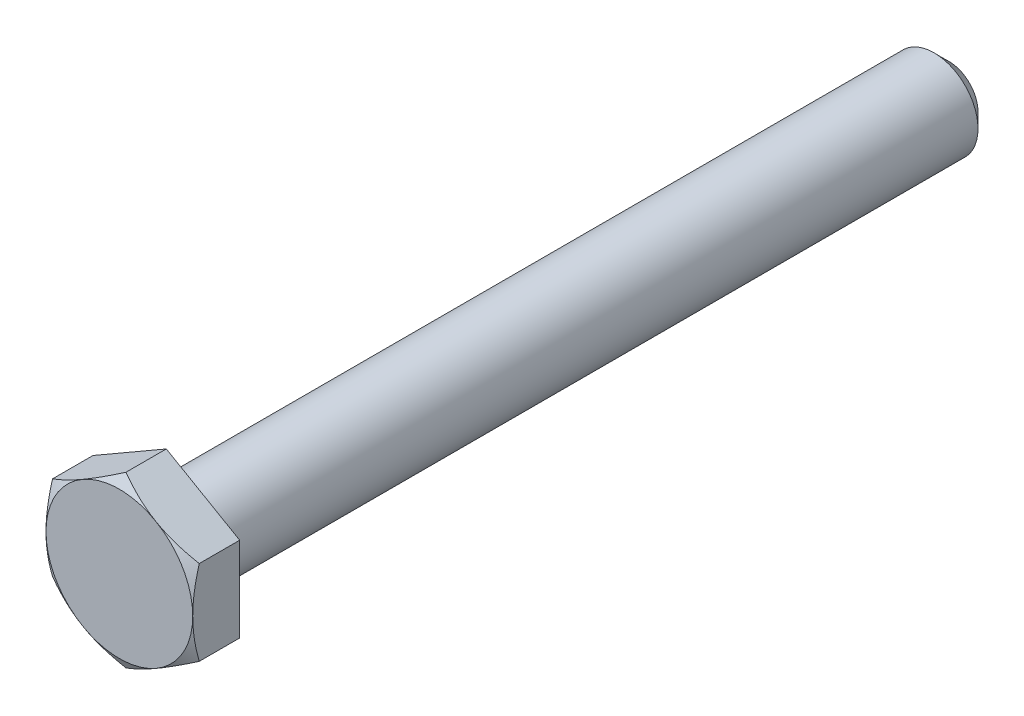
from build123d import *

# Parameters (mm, degrees)
EXTRUDE3_DEPTH     = 1.524
SKETCH4_W          = 25.4
SKETCH4_H          = 1.4224
CHAMFER2_SIZE      = 0.47625
SKETCH26_R         = 0.5461
EXTRUDE12_DEPTH    = 1.524
SKETCH30_OUTSIDE_W = 21.138
SKETCH30_OUTSIDE_H = 21.876
SKETCH30_OUTSIDE_R = 2.38125
EXTRUDE13_DEPTH    = 2.54
EXTRUDE13_DRAFT    = -60


with BuildPart() as part:
    # Sketch1 → Extrude3 (new body)
    with BuildSketch(Plane.XY):
        Polygon((-2.38125, -1.374815329), (0, -2.749630657), (2.38125, -1.374815329), (2.38125, 1.374815329), (0, 2.749630657), (-2.38125, 1.374815329), align=None)
    extrude(amount=EXTRUDE3_DEPTH)



with BuildPart() as body_2:
    # Sketch4 → Revolve1 (revolve)
    with BuildSketch(Plane(origin=(0, 0, 0), x_dir=(0, 0, -1), z_dir=(1, 0, 0)), mode=Mode.PRIVATE) as revolve1_sk:
        with Locations((12.7, 0.7112)):
            Rectangle(SKETCH4_W, SKETCH4_H)
    revolve(revolve1_sk.sketch.rotate(Axis((0, 0, 0), (0, 0, -1)), 90), axis=Axis((0, 0, 0), (0, 0, -1)))

    # Chamfer2
    chamfer2_edges = [body_2.edges().sort_by_distance(p)[0] for p in [
        (-1.4224, 0, -25.4),
    ]]
    chamfer(chamfer2_edges, length=CHAMFER2_SIZE)


with BuildPart() as part_1:
    add(part.part)

    add(body_2.part)  # Extrude12 merges body 2
    # Sketch26 → Extrude12 (add)
    with BuildSketch(Plane.XY):
        Circle(SKETCH26_R)
    extrude(amount=EXTRUDE12_DEPTH)


with BuildPart() as extrude13_tool:
    # Sketch30 outside → Extrude13 (with draft: the straight prism first)
    with BuildSketch(Plane.XY.offset(1.524)):
        Rectangle(SKETCH30_OUTSIDE_W, SKETCH30_OUTSIDE_H)
        Circle(SKETCH30_OUTSIDE_R, mode=Mode.SUBTRACT)
    extrude(amount=-EXTRUDE13_DEPTH)
    # Extrude13: the draft: its side faces are tilted about the plane it starts from
    extrude13_sides = [extrude13_tool.faces().sort_by_distance(p)[0] for p in [
        (0, -10.938, 0.254),
        (10.569, 0, 0.254),
        (0, 10.938, 0.254),
        (-10.569, 0, 0.254),
        (-2.38125, 0, 0.254),
    ]]
    draft(extrude13_sides, Plane.XY.offset(1.524), EXTRUDE13_DRAFT)


with BuildPart() as part_2:
    add(part_1.part)

    # Extrude13: cut by extrude13_tool
    add(extrude13_tool.part, mode=Mode.SUBTRACT)


solid = part_2.part
